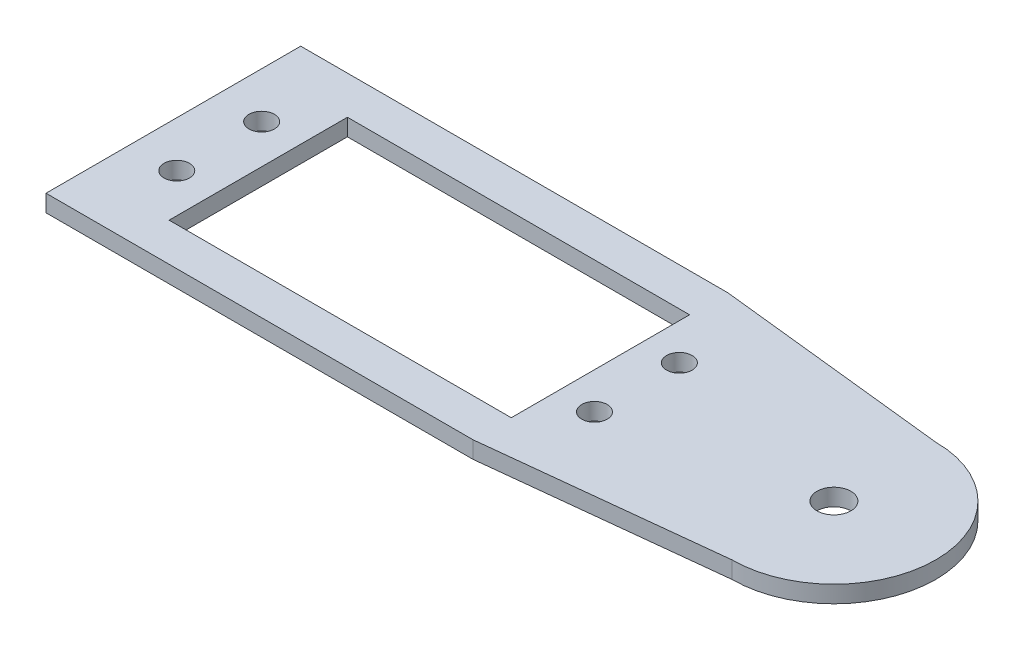
from build123d import *

# Parameters (mm, degrees)
SKETCH_1_R         = 1.5
SKETCH_1_R_2       = 2
SKETCH_1_W         = 40.3
SKETCH_1_H         = 21
EXTRUDE_1090_DEPTH = 2


with BuildPart() as part:
    # Эскиз1 → Extrude 1090 (new body)
    with BuildSketch(Plane(origin=(0, 0, 0), x_dir=(1, 0, 0), z_dir=(0, 1, 0))):
        with BuildLine():
            Line((0, 15), (50.3, 15))
            Line((50.3, 15), (77.8, 12))
            ThreePointArc((77.8, 12), (89.8, 0), (77.8, -12))
            Line((77.8, -12), (50.3, -15))
            Line((50.3, -15), (0, -15))
            Line((0, -15), (0, 15))
        make_face()
        with Locations(Location((5.4, -5, 0), (0, 0, 270))):
            Circle(SKETCH_1_R, mode=Mode.SUBTRACT)
        with Locations(Location((5.4, 5, 0), (0, 0, 270))):
            Circle(SKETCH_1_R, mode=Mode.SUBTRACT)
        with Locations(Location((54.6, -5, 0), (0, 0, 270))):
            Circle(SKETCH_1_R, mode=Mode.SUBTRACT)
        with Locations(Location((54.6, 5, 0), (0, 0, 270))):
            Circle(SKETCH_1_R, mode=Mode.SUBTRACT)
        with Locations(Location((77.8, 0, 0), (0, 0, 270))):
            Circle(SKETCH_1_R_2, mode=Mode.SUBTRACT)
        with Locations((30.15, 0)):
            Rectangle(SKETCH_1_W, SKETCH_1_H, mode=Mode.SUBTRACT)
    extrude(amount=EXTRUDE_1090_DEPTH)


solid = part.part
